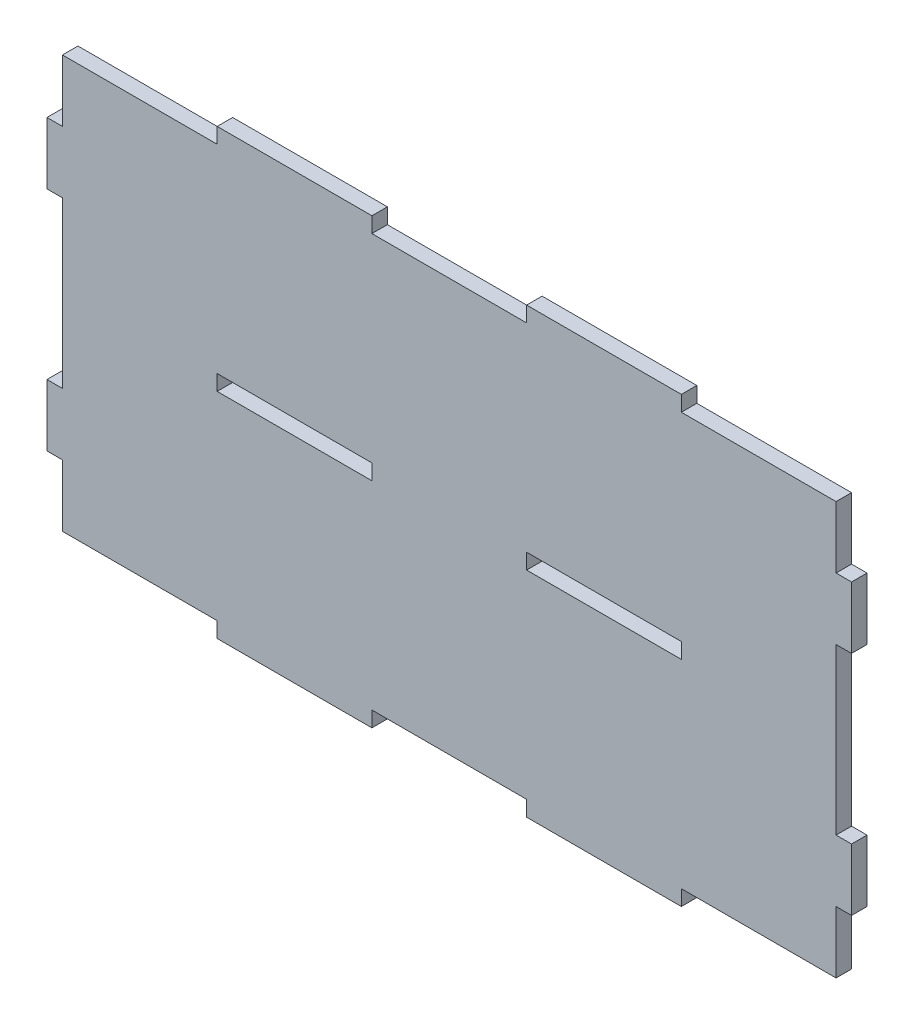
from build123d import *

# Parameters (mm, degrees)
ESBO_O1_W                = 30
ESBO_O1_H                = 3
RESSALTO_EXTRUS_O1_DEPTH = 3


with BuildPart() as part:
    # Esboço1 → Ressalto-extrusão1 (new body)
    with BuildSketch(Plane.XY):
        Polygon((45, 40), (75, 40), (75, 28), (78, 28), (78, 16), (75, 16), (75, -16), (78, -16), (78, -28), (75, -28), (75, -40), (45, -40), (45, -43), (15, -43), (15, -40), (-15, -40), (-15, -43), (-45, -43), (-45, -40), (-75, -40), (-75, -28), (-78, -28), (-78, -16), (-75, -16), (-75, 16), (-78, 16), (-78, 28), (-75, 28), (-75, 40), (-45, 40), (-45, 43), (-15, 43), (-15, 40), (15, 40), (15, 43), (45, 43), align=None)
        with Locations((30, 0)):
            Rectangle(ESBO_O1_W, ESBO_O1_H, mode=Mode.SUBTRACT)
        with Locations((-30, 0)):
            Rectangle(ESBO_O1_W, ESBO_O1_H, mode=Mode.SUBTRACT)
    extrude(amount=RESSALTO_EXTRUS_O1_DEPTH)


solid = part.part
